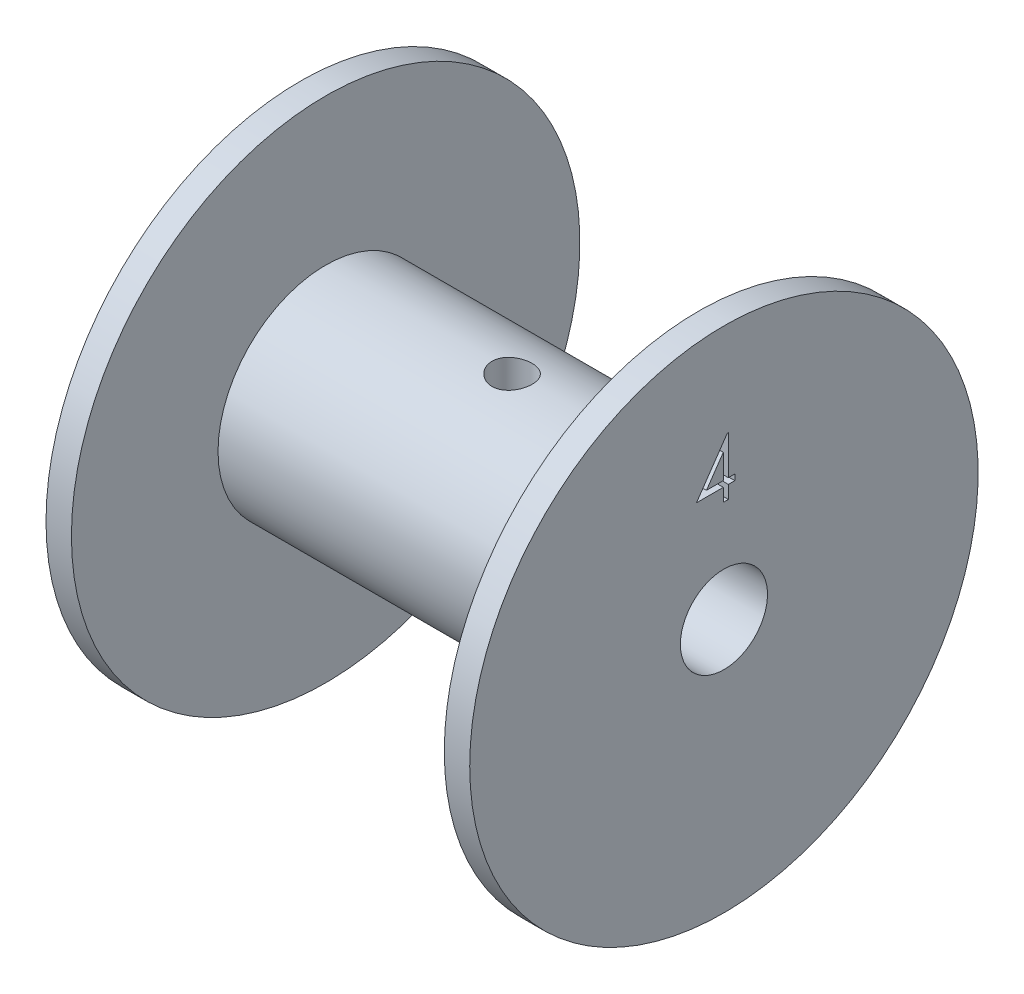
from build123d import *

# Parameters (mm, degrees)
SKETCH2_R          = 1.5
CUT_EXTRUDE1_DEPTH = 32.270123521
CUT_EXTRUDE2_DEPTH = 1.27


with BuildPart() as part:
    # Sketch1 → Revolve1 (revolve)
    with BuildSketch(Plane.XY):
        Polygon((15.875, 3.2639), (15.875, 19.05), (13.97, 19.05), (13.97, 8.0645), (-13.97, 8.0645), (-13.97, 19.05), (-15.875, 19.05), (-15.875, 3.2639), align=None)
    revolve(axis=Axis((-15.275524476, 0, 0), (1, 0, 0)))

    # Sketch2 → Cut-Extrude1 (cut, through all)
    with BuildSketch(Plane(origin=(0, 0, 0), x_dir=(1, 0, 0), z_dir=(0, 1, 0))):
        Circle(SKETCH2_R)
    extrude(amount=CUT_EXTRUDE1_DEPTH, mode=Mode.SUBTRACT)

    # Sketch3 → Cut-Extrude2 (cut)
    with BuildSketch(Plane(origin=(15.875, 0, 0), x_dir=(0, 0, -1), z_dir=(1, 0, 0))):
        Polygon((0.253501878, 11.957106949), (0.330672017, 11.957106949), (0.330672017, 9.026337718), (0.819133555, 9.026337718), (0.819133555, 8.592149684), (0.330672017, 8.592149684), (0.330672017, 7.615226607), (-0.049242513, 7.615226607), (-0.049242513, 8.592149684), (-2.057362172, 8.592149684), align=None)
        Polygon((-0.049242513, 9.026337718), (-0.049242513, 10.863156629), (-1.310253464, 9.026337718), align=None, mode=Mode.SUBTRACT)
    extrude(amount=-CUT_EXTRUDE2_DEPTH, mode=Mode.SUBTRACT)


solid = part.part
